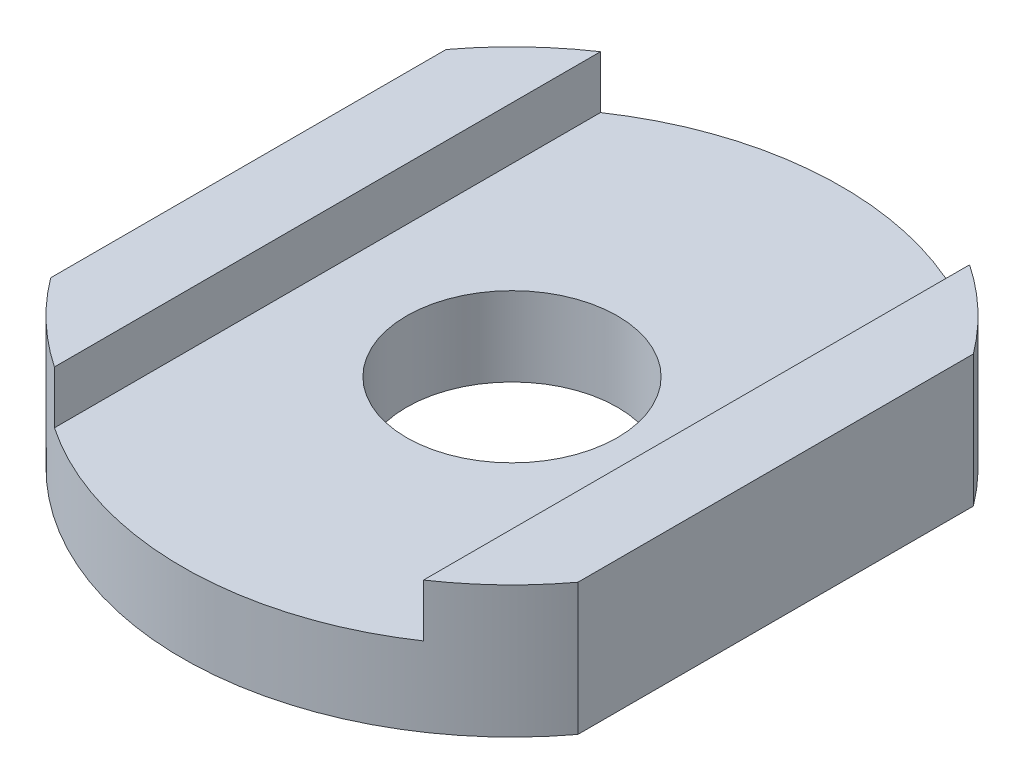
from build123d import *

# Parameters (mm, degrees)
SZKIC1_R                    = 4
DODANIE_WYCI_GNI_CIE1_DEPTH = 3
DODANIE_WYCI_GNI_CIE2_DEPTH = 2


with BuildPart() as part:
    # Szkic1 → Dodanie-wyciągnięcie1 (new body)
    with BuildSketch(Plane(origin=(0, 0, 0), x_dir=(1, 0, 0), z_dir=(0, 1, 0))):
        with BuildLine():
            Line((-10, 7.5), (-10, -7.5))
            ThreePointArc((-10, -7.5), (0, -12.5), (10, -7.5))
            Line((10, -7.5), (10, 7.5))
            ThreePointArc((10, 7.5), (0, 12.5), (-10, 7.5))
        make_face()
        with Locations(Location((0, 0, 0), (0, 0, 270))):
            Circle(SZKIC1_R, mode=Mode.SUBTRACT)
    extrude(amount=DODANIE_WYCI_GNI_CIE1_DEPTH)

    # Szkic2 → Dodanie-wyciągnięcie2 (add)
    with BuildSketch(Plane(origin=(0, 3, 0), x_dir=(1, 0, 0), z_dir=(0, 1, 0))):
        with BuildLine():
            Line((-10, 7.5), (-10, -7.5))
            ThreePointArc((-10, -7.5), (-8.619130411, -9.053208876), (-7, -10.356157589))
            Line((-7, -10.356157589), (-7, 10.356157589))
            ThreePointArc((-7, 10.356157589), (-8.619130411, 9.053208876), (-10, 7.5))
        make_face()
        with BuildLine():
            Line((7, 10.356157589), (7, -10.356157589))
            ThreePointArc((7, -10.356157589), (8.619130411, -9.053208876), (10, -7.5))
            Line((10, -7.5), (10, 7.5))
            ThreePointArc((10, 7.5), (8.619130411, 9.053208876), (7, 10.356157589))
        make_face()
    extrude(amount=DODANIE_WYCI_GNI_CIE2_DEPTH)


solid = part.part
